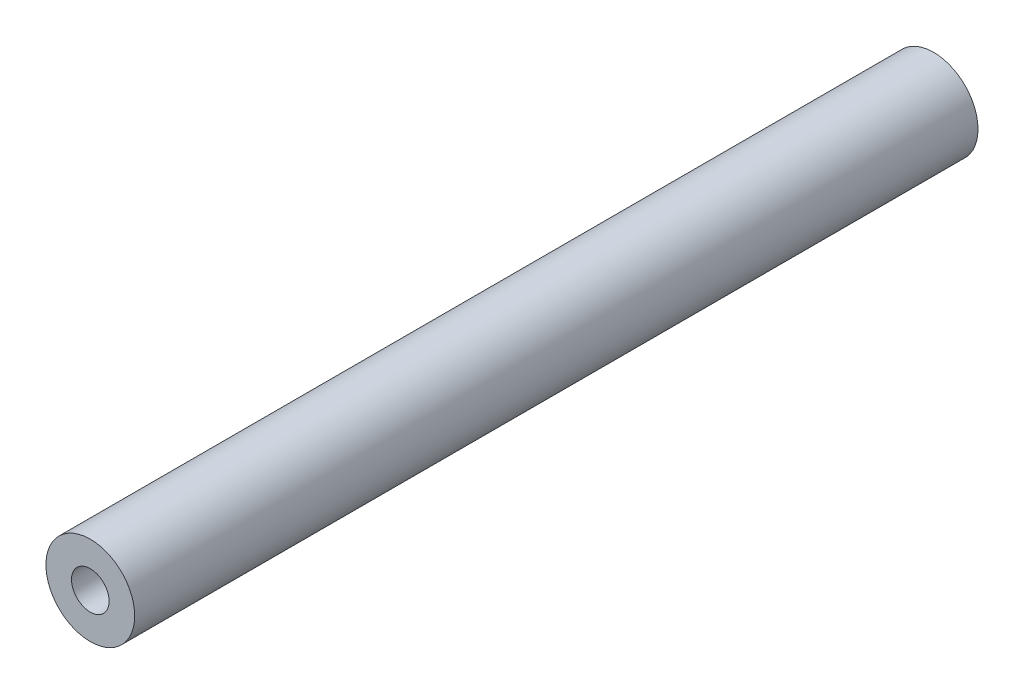
from build123d import *

# Parameters (mm, degrees)
SKETCH1_R                        = 4.7625
BOSS_EXTRUDE1_DEPTH              = 90.4875
F_10_32_TAPPED_HOLE1_D           = 4.0386
F_10_32_TAPPED_HOLE1_ON_FACE_2_D = 4.0386


with BuildPart() as part:
    # Sketch1 → Boss-Extrude1 (new body)
    with BuildSketch(Plane.XY):
        Circle(SKETCH1_R)
    extrude(amount=BOSS_EXTRUDE1_DEPTH)

    # #10-32 Tapped Hole1 (through all)
    with Locations(Plane.XY.offset(90.4875)):
        with Locations((0, 0)):
            Hole(F_10_32_TAPPED_HOLE1_D / 2)

    # #10-32 Tapped Hole1 on face 2 (through all)
    with Locations(Plane(origin=(0, 0, 0), x_dir=(-1, 0, 0), z_dir=(0, 0, -1))):
        with Locations((0, 0)):
            Hole(F_10_32_TAPPED_HOLE1_ON_FACE_2_D / 2)


solid = part.part
